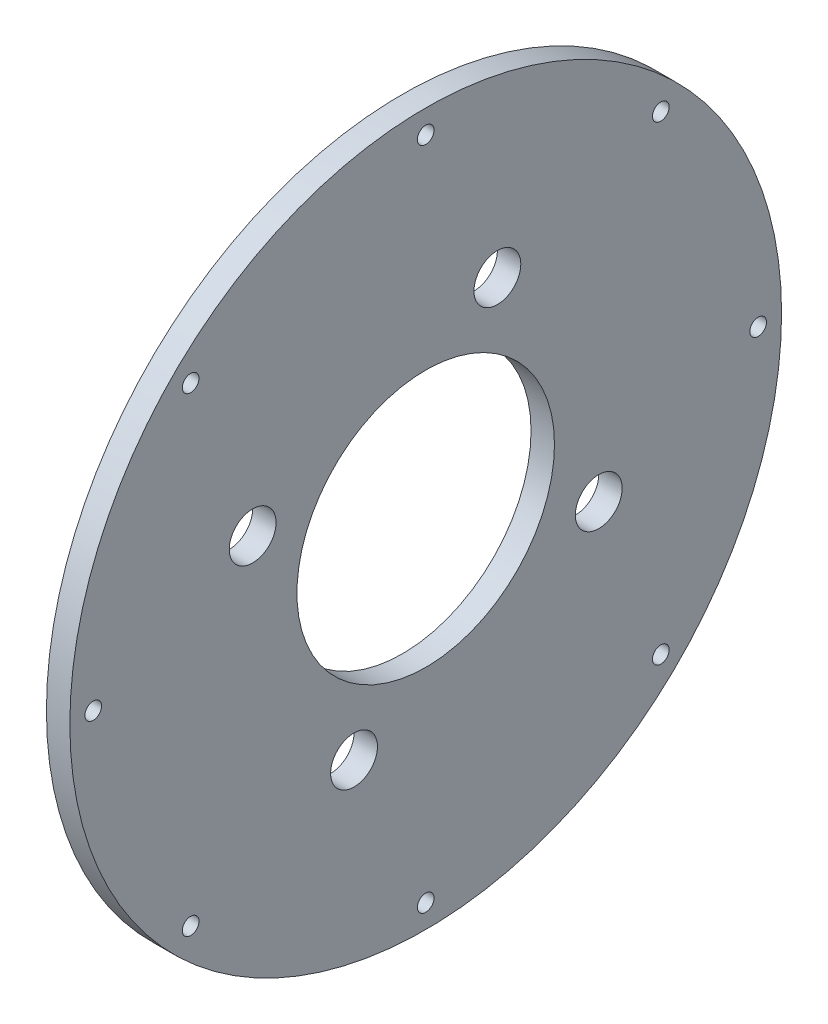
from build123d import *

# Parameters (mm, degrees)
SKETCH1_R           = 48.26
SKETCH1_R_2         = 1.1303
SKETCH1_R_3         = 17.4625
SKETCH1_R_4         = 3.175
BOSS_EXTRUDE1_DEPTH = 3.175


with BuildPart() as part:
    # Sketch1 → Boss-Extrude1 (new body)
    with BuildSketch(Plane(origin=(0, 0, 0), x_dir=(0, 0, -1), z_dir=(1, 0, 0))):
        Circle(SKETCH1_R)
        with Locations((0, 45.085)):
            Circle(SKETCH1_R_2, mode=Mode.SUBTRACT)
        with Locations((31.87990923, 31.87990923)):
            Circle(SKETCH1_R_2, mode=Mode.SUBTRACT)
        with Locations((45.085, 0)):
            Circle(SKETCH1_R_2, mode=Mode.SUBTRACT)
        with Locations((31.87990923, -31.87990923)):
            Circle(SKETCH1_R_2, mode=Mode.SUBTRACT)
        with Locations((0, -45.085)):
            Circle(SKETCH1_R_2, mode=Mode.SUBTRACT)
        with Locations((-31.87990923, -31.87990923)):
            Circle(SKETCH1_R_2, mode=Mode.SUBTRACT)
        with Locations((-45.085, 0)):
            Circle(SKETCH1_R_2, mode=Mode.SUBTRACT)
        with Locations((-31.87990923, 31.87990923)):
            Circle(SKETCH1_R_2, mode=Mode.SUBTRACT)
        Circle(SKETCH1_R_3, mode=Mode.SUBTRACT)
        with Locations((9.720159182, 23.466540126)):
            Circle(SKETCH1_R_4, mode=Mode.SUBTRACT)
        with Locations((23.466540126, -9.720159182)):
            Circle(SKETCH1_R_4, mode=Mode.SUBTRACT)
        with Locations((-9.720159182, -23.466540126)):
            Circle(SKETCH1_R_4, mode=Mode.SUBTRACT)
        with Locations((-23.466540126, 9.720159182)):
            Circle(SKETCH1_R_4, mode=Mode.SUBTRACT)
    extrude(amount=BOSS_EXTRUDE1_DEPTH)


solid = part.part
